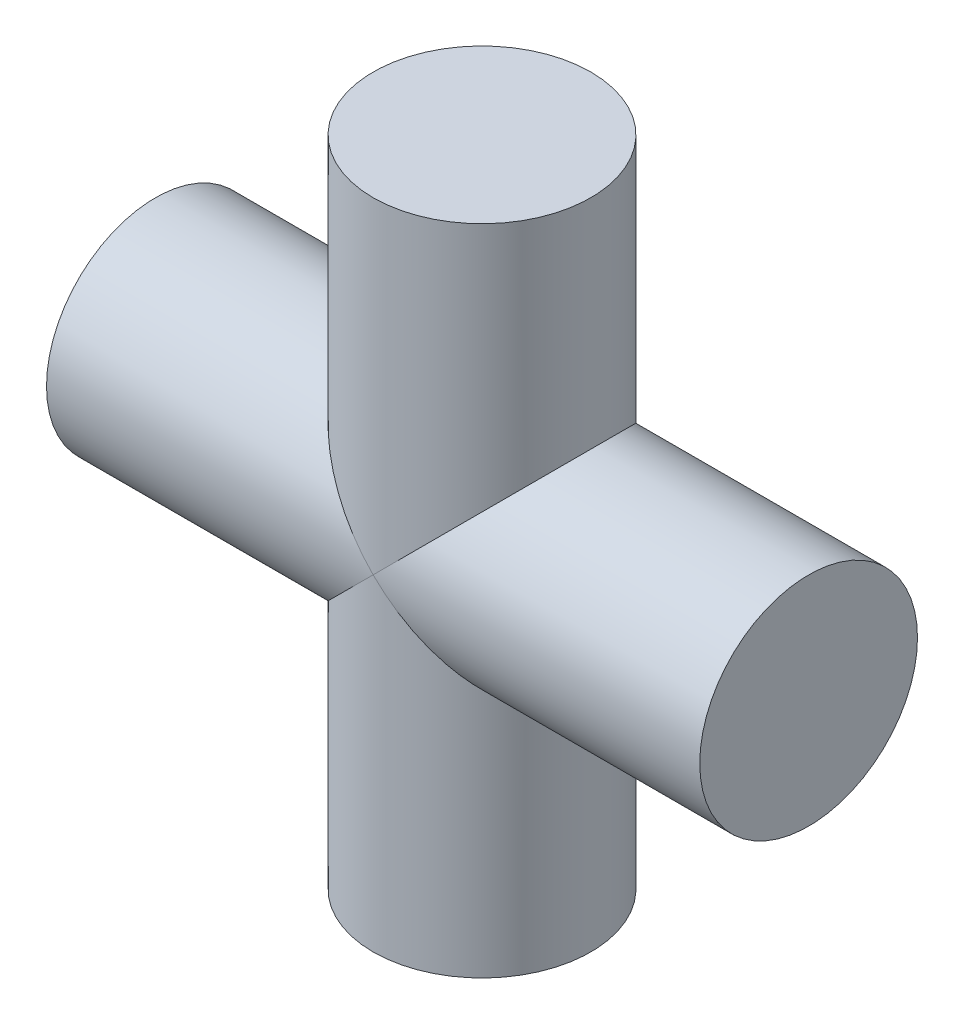
from build123d import *

# Parameters (mm, degrees)
SKETCH1_R           = 50
BOSS_EXTRUDE1_DEPTH = 150
SKETCH2_R           = 50
BOSS_EXTRUDE2_DEPTH = 150


with BuildPart() as part:
    # Sketch1 → Boss-Extrude1 (new, symmetric)
    with BuildSketch(Plane(origin=(0, 0, 0), x_dir=(1, 0, 0), z_dir=(0, 1, 0))):
        with Locations(Location((0, 0, 0), (0, 0, 270))):
            Circle(SKETCH1_R)
    extrude(amount=BOSS_EXTRUDE1_DEPTH, both=True)

    # Sketch2 → Boss-Extrude2 (add, symmetric)
    with BuildSketch(Plane(origin=(0, 0, 0), x_dir=(0, 0, -1), z_dir=(1, 0, 0))):
        Circle(SKETCH2_R)
    extrude(amount=BOSS_EXTRUDE2_DEPTH, both=True)


solid = part.part
